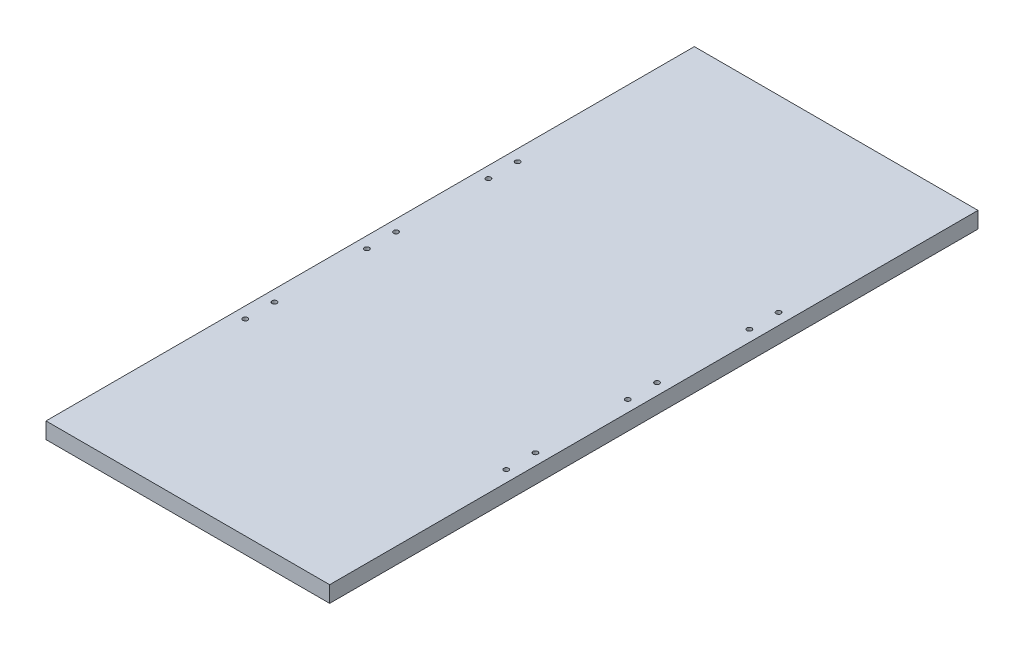
from build123d import *

# Parameters (mm, degrees)
SKETCH_1_W          = 175
SKETCH_1_H          = 400
EXTRUDE_1_DEPTH     = 10
SKETCH_3_R          = 1.5
CUT_EXTRUDE_1_DEPTH = 10


with BuildPart() as part:
    # 草图1 → 凸台-拉伸1 (new body)
    with BuildSketch(Plane(origin=(0, 0, 0), x_dir=(1, 0, 0), z_dir=(0, 1, 0))):
        Rectangle(SKETCH_1_W, SKETCH_1_H)
    extrude(amount=EXTRUDE_1_DEPTH)

    # 草图3 → 切除-拉伸1 (cut)
    with BuildSketch(Plane.XZ):
        with Locations(Location((-80.5, -83.96, 0), (0, 0, 270))):
            Circle(SKETCH_3_R)
        with Locations(Location((-80.5, -65.96, 0), (0, 0, 270))):
            Circle(SKETCH_3_R)
        with Locations(Location((-80.5, -8.96, 0), (0, 0, 270))):
            Circle(SKETCH_3_R)
        with Locations(Location((-80.5, 9.04, 0), (0, 0, 270))):
            Circle(SKETCH_3_R)
        with Locations(Location((-80.5, 66.04, 0), (0, 0, 270))):
            Circle(SKETCH_3_R)
        with Locations(Location((-80.5, 84.04, 0), (0, 0, 270))):
            Circle(SKETCH_3_R)
    cut_extrude_1 = extrude(amount=-CUT_EXTRUDE_1_DEPTH, mode=Mode.SUBTRACT)

    # 镜向1: 切除-拉伸1 across plane
    add(cut_extrude_1.mirror(Plane(origin=(0, 0, 0), x_dir=(0, 0, 1), z_dir=(1, 0, 0))), mode=Mode.SUBTRACT)


solid = part.part
